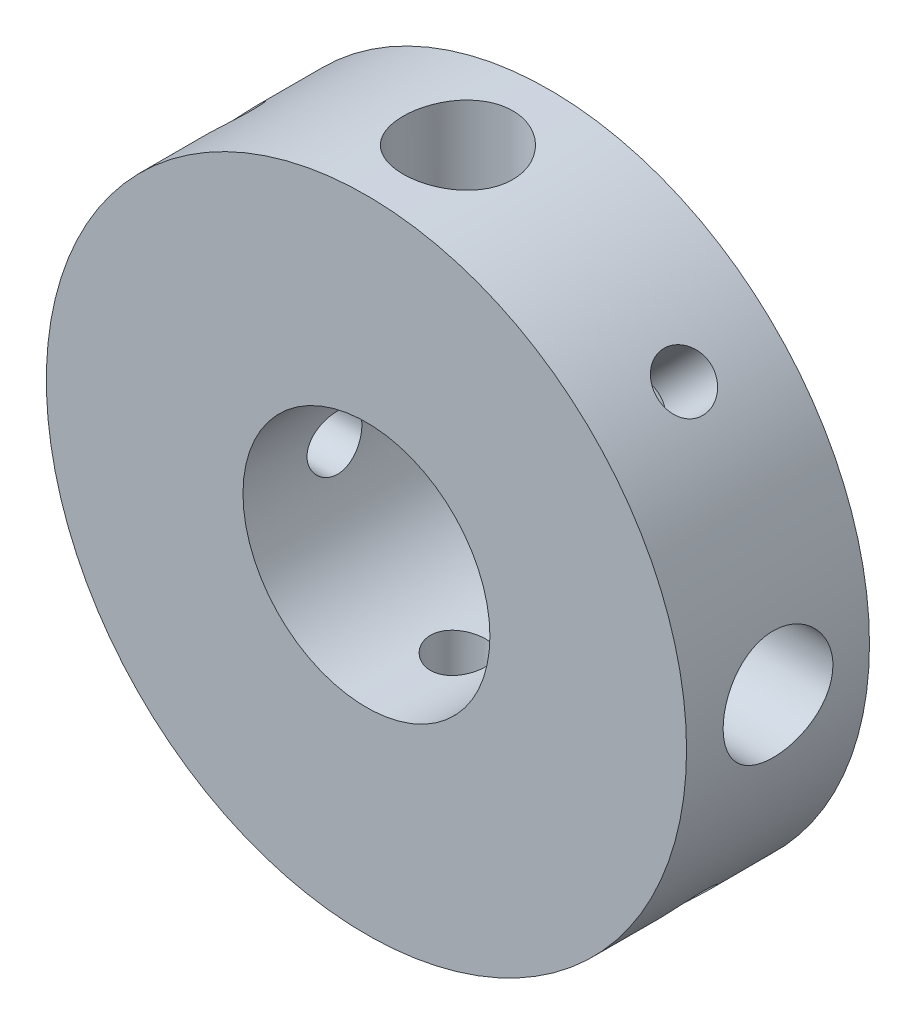
from build123d import *

# Parameters (mm, degrees)
ESBO_O1_R                = 17.5
ESBO_O1_R_2              = 6.75
RESSALTO_EXTRUS_O1_DEPTH = 10
ESBO_O2_R                = 3
CORTE_EXTRUS_O1_DEPTH    = 6
CORTE_EXTRUS_O2_REACH    = 42.389
ESBO_O2_3_R              = 1.5
PADR_OCIRCULAR1_COUNT    = 4
ESBO_O5_R                = 1.5
CORTE_EXTRUS_O3_DEPTH    = 5
PADR_OCIRCULAR2_COUNT    = 4
CORTE_EXTRUS_O4_DEPTH    = 7.75
PADR_OCIRCULAR3_COUNT    = 4


with BuildPart() as part:
    # Esboço1 → Ressalto-extrusão1 (new body)
    with BuildSketch(Plane.XY):
        Circle(ESBO_O1_R)
        Circle(ESBO_O1_R_2, mode=Mode.SUBTRACT)
    extrude(amount=RESSALTO_EXTRUS_O1_DEPTH)

    # Esboço2 → Corte-extrusão1 (cut)
    with BuildSketch(Plane(origin=(0, 17.5, 0), x_dir=(1, 0, 0), z_dir=(0, 1, 0))):
        with Locations((0, -5)):
            Circle(ESBO_O2_R)
    corte_extrus_o1 = extrude(amount=-CORTE_EXTRUS_O1_DEPTH, mode=Mode.SUBTRACT)

    # Esboço2<3> → Corte-extrusão2 (cut, up to next)
    with BuildSketch(Plane(origin=(0, 17.5, 0), x_dir=(1, 0, 0), z_dir=(0, 1, 0)), mode=Mode.PRIVATE) as corte_extrus_o2_sk1:
        with Locations((0, -5)):
            Circle(ESBO_O2_3_R)
    corte_extrus_o2_tool1 = extrude(corte_extrus_o2_sk1.sketch, amount=-CORTE_EXTRUS_O2_REACH, mode=Mode.PRIVATE) & part.part
    corte_extrus_o2 = corte_extrus_o2_tool1.solids().sort_by_distance((0, 17.5, 5))[0]
    add(corte_extrus_o2, mode=Mode.SUBTRACT)

    # PadrãoCircular1: Corte-extrusão1, Corte-extrusão2 ×4 about axis
    padr_ocircular1_axis = Axis((0, 0, 0), (0, 0, 1))
    add([corte_extrus_o1.rotate(padr_ocircular1_axis, i * 360 / PADR_OCIRCULAR1_COUNT) for i in range(1, PADR_OCIRCULAR1_COUNT)], mode=Mode.SUBTRACT)
    add([corte_extrus_o2.rotate(padr_ocircular1_axis, i * 360 / PADR_OCIRCULAR1_COUNT) for i in range(1, PADR_OCIRCULAR1_COUNT)], mode=Mode.SUBTRACT)

    # Esboço5 → Corte-extrusão3 (cut)
    with BuildSketch(Plane(origin=(-12.374368671, 12.374368671, 0), x_dir=(0, 0, -1), z_dir=(-0.7071067811865488, 0.7071067811865464, 0))):
        with Locations((-5, 0)):
            Circle(ESBO_O5_R)
    corte_extrus_o3 = extrude(amount=-CORTE_EXTRUS_O3_DEPTH, mode=Mode.SUBTRACT)

    # PadrãoCircular2: Corte-extrusão3 ×4 about axis
    padr_ocircular2_axis = Axis((0, 0, 0), (0, 0, 1))
    for i in range(1, PADR_OCIRCULAR2_COUNT):
        add(corte_extrus_o3.rotate(padr_ocircular2_axis, i * 360 / PADR_OCIRCULAR2_COUNT), mode=Mode.SUBTRACT)

    # Esboço6 → Corte-extrusão4 (cut)
    with BuildSketch(Plane(origin=(0, 0, 0), x_dir=(-1, 0, 0), z_dir=(0, 0, -1))):
        Polygon((-11.313708499, 7.778174593), (-7.778174593, 11.313708499), (-5.656854249, 9.192388155), (-9.192388155, 5.656854249), align=None)
    corte_extrus_o4 = extrude(amount=-CORTE_EXTRUS_O4_DEPTH, mode=Mode.SUBTRACT)

    # PadrãoCircular3: Corte-extrusão4 ×4 about axis
    padr_ocircular3_axis = Axis((0, 0, 0), (0, 0, 1))
    for i in range(1, PADR_OCIRCULAR3_COUNT):
        add(corte_extrus_o4.rotate(padr_ocircular3_axis, i * 360 / PADR_OCIRCULAR3_COUNT), mode=Mode.SUBTRACT)


solid = part.part
